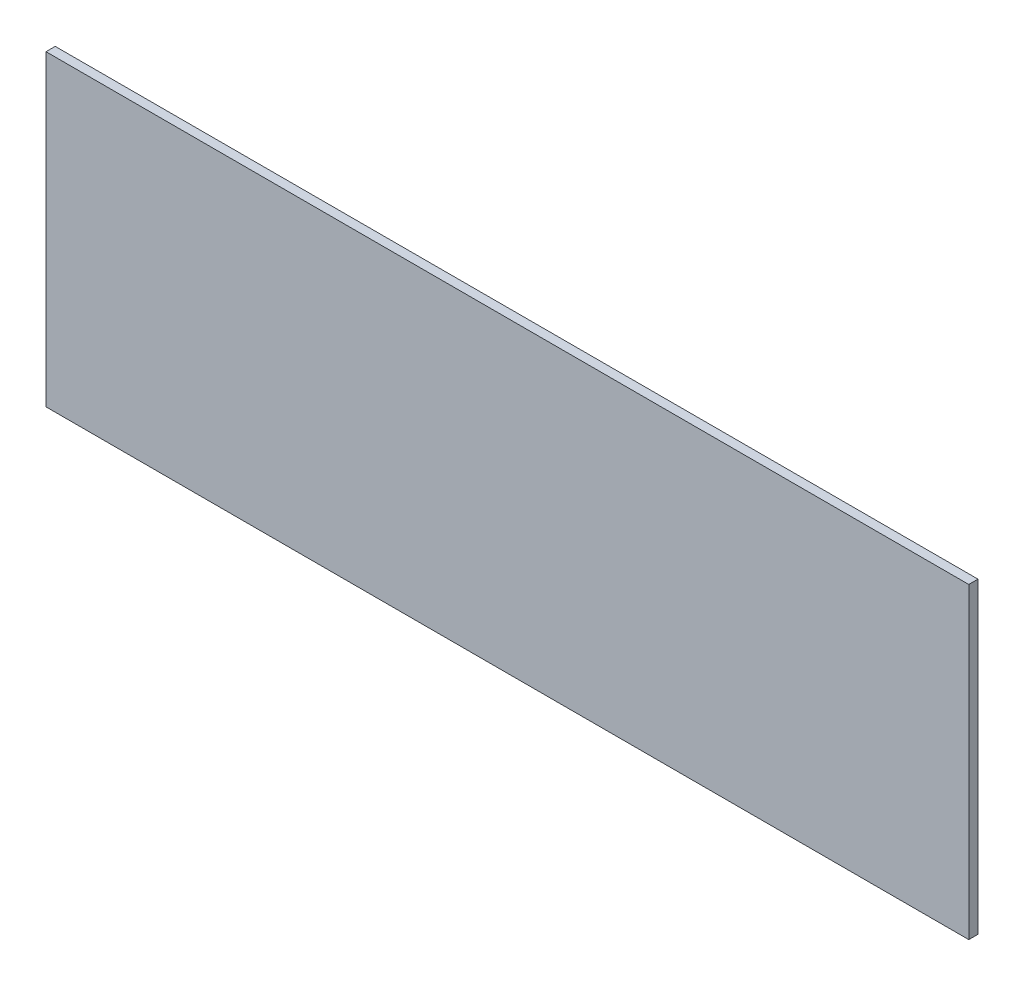
from build123d import *

# Parameters (mm, degrees)
SKETCH1_W           = 300
SKETCH1_H           = 100
BOSS_EXTRUDE1_DEPTH = 3


with BuildPart() as part:
    # Sketch1 → Boss-Extrude1 (new body)
    with BuildSketch(Plane.XY):
        with Locations((150, 50)):
            Rectangle(SKETCH1_W, SKETCH1_H)
    extrude(amount=BOSS_EXTRUDE1_DEPTH)


solid = part.part
